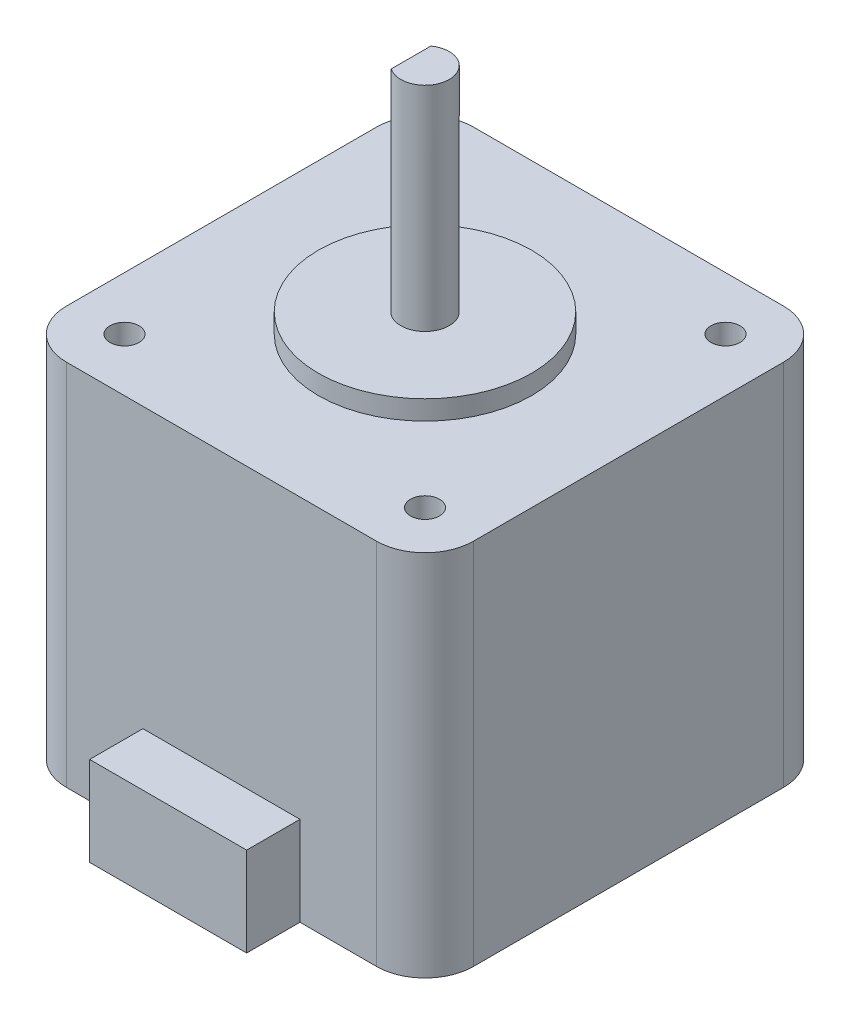
from build123d import *

# Parameters (mm, degrees)
SKETCH_1_W          = 42
SKETCH_1_H          = 42
EXTRUDE_1_DEPTH     = 38
SKETCH_2_R          = 11
EXTRUDE_2_DEPTH     = 2
SKETCH_3_R          = 2.5
EXTRUDE_3_DEPTH     = 22
SKETCH_5_W          = 16.2
SKETCH_5_H          = 9.2
EXTRUDE_4_DEPTH     = 5.5
SKETCH_6_R          = 1.5
CUT_EXTRUDE_1_DEPTH = 5
FILLET_1_R          = 5
SKETCH_7_R          = 4
CUT_EXTRUDE_2_DEPTH = 5
CUT_EXTRUDE_START   = -20
CUT_EXTRUDE_3_DEPTH = 20


with BuildPart() as part:
    # 草图1 → 凸台-拉伸1 (new body)
    with BuildSketch(Plane(origin=(0, 0, 0), x_dir=(1, 0, 0), z_dir=(0, 1, 0))):
        Rectangle(SKETCH_1_W, SKETCH_1_H)
    extrude(amount=EXTRUDE_1_DEPTH)

    # 草图2 → 凸台-拉伸2 (add)
    with BuildSketch(Plane(origin=(0, 38, 0), x_dir=(1, 0, 0), z_dir=(0, 1, 0))):
        with Locations(Location((0, 0, 0), (0, 0, 270))):
            Circle(SKETCH_2_R)
    extrude(amount=EXTRUDE_2_DEPTH)

    # 草图3 → 凸台-拉伸3 (add)
    with BuildSketch(Plane(origin=(0, 40, 0), x_dir=(1, 0, 0), z_dir=(0, 1, 0))):
        with Locations(Location((0, 0, 0), (0, 0, 270))):
            Circle(SKETCH_3_R)
    extrude(amount=EXTRUDE_3_DEPTH)

    # 草图5 → 凸台-拉伸4 (add)
    with BuildSketch(Plane.XY.offset(21)):
        with Locations((0, 4.6)):
            Rectangle(SKETCH_5_W, SKETCH_5_H)
    extrude(amount=EXTRUDE_4_DEPTH)

    # 草图6 → 切除-拉伸1 (cut)
    with BuildSketch(Plane(origin=(0, 38, 0), x_dir=(1, 0, 0), z_dir=(0, 1, 0))):
        with Locations(Location((-15.5, 15.5, 0), (0, 0, 270))):
            Circle(SKETCH_6_R)
        with Locations(Location((15.5, 15.5, 0), (0, 0, 270))):
            Circle(SKETCH_6_R)
        with Locations(Location((15.5, -15.5, 0), (0, 0, 270))):
            Circle(SKETCH_6_R)
        with Locations(Location((-15.5, -15.5, 0), (0, 0, 270))):
            Circle(SKETCH_6_R)
    extrude(amount=-CUT_EXTRUDE_1_DEPTH, mode=Mode.SUBTRACT)

    # 圆角1
    fillet_1_edges = [part.edges().sort_by_distance(p)[0] for p in [
        (21, 19, 21),
        (-21, 19, 21),
        (-21, 19, -21),
        (21, 19, -21),
    ]]
    fillet(fillet_1_edges, radius=FILLET_1_R)

    # 草图7 → 切除-拉伸2 (cut)
    with BuildSketch(Plane.XZ):
        with Locations(Location((0, 0, 0), (0, 0, 270))):
            Circle(SKETCH_7_R)
    extrude(amount=-CUT_EXTRUDE_2_DEPTH, mode=Mode.SUBTRACT)

    # 草图8 → 切除-拉伸3 (cut)
    with BuildSketch(Plane(origin=(0, 62, 0), x_dir=(1, 0, 0), z_dir=(0, 1, 0)).offset(CUT_EXTRUDE_START)):
        with BuildLine():
            Line((-1.438247, -2.044858324), (-1.438247, 2.044858324))
            ThreePointArc((-1.438247, 2.044858324), (-2.5, 0), (-1.438247, -2.044858324))
        make_face()
    extrude(amount=CUT_EXTRUDE_3_DEPTH, mode=Mode.SUBTRACT)


solid = part.part
